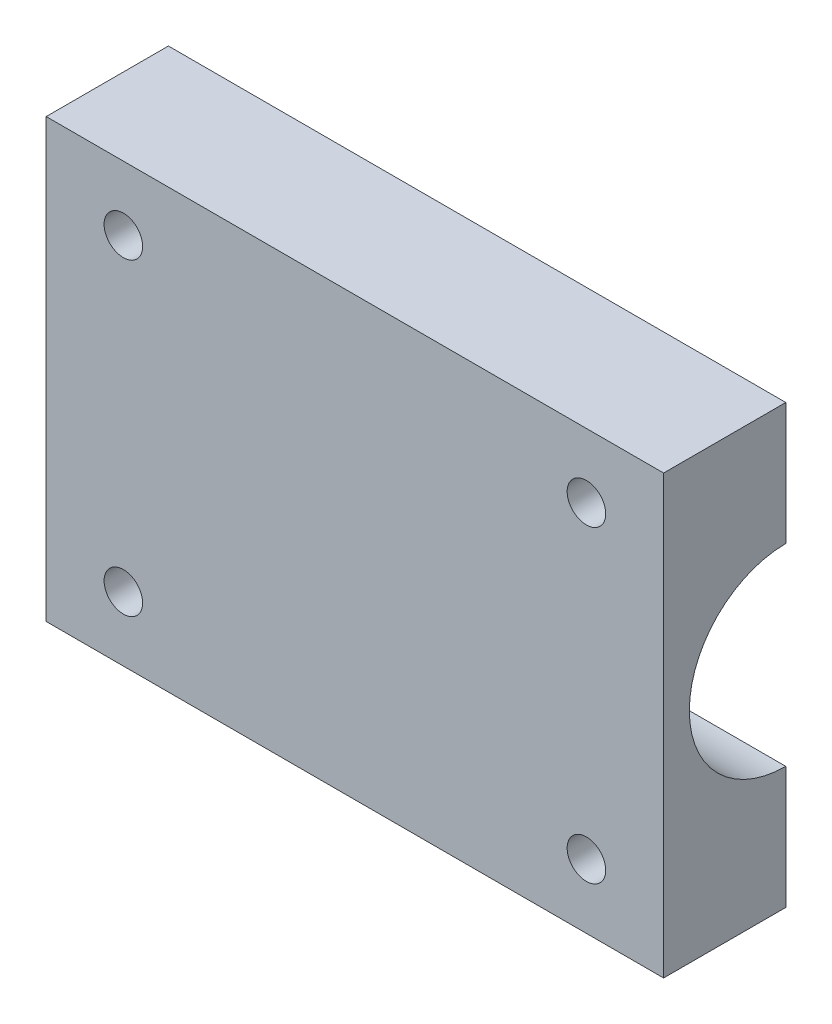
from build123d import *

# Parameters (mm, degrees)
SKETCH_1_W          = 48
SKETCH_1_H          = 34
SKETCH_1_R          = 1.5
EXTRUDE_1_DEPTH     = 9.5
SKETCH_2_R          = 7.5
CUT_EXTRUDE_1_DEPTH = 54.5


with BuildPart() as part:
    # 草图1 → 凸台-拉伸1 (new body)
    with BuildSketch(Plane.XY):
        with Locations((-0.042857143, -0.364285714)):
            Rectangle(SKETCH_1_W, SKETCH_1_H)
        with Locations((-18.042857143, 11.635714286)):
            Circle(SKETCH_1_R, mode=Mode.SUBTRACT)
        with Locations((17.957142857, 11.635714286)):
            Circle(SKETCH_1_R, mode=Mode.SUBTRACT)
        with Locations((-18.042857143, -12.364285714)):
            Circle(SKETCH_1_R, mode=Mode.SUBTRACT)
        with Locations((17.957142857, -12.364285714)):
            Circle(SKETCH_1_R, mode=Mode.SUBTRACT)
    extrude(amount=EXTRUDE_1_DEPTH)

    # 草图2 → 切除-拉伸1 (cut)
    with BuildSketch(Plane(origin=(23.957142857, 0, 0), x_dir=(0, 0, -1), z_dir=(1, 0, 0))):
        with Locations((0, -0.364285714)):
            Circle(SKETCH_2_R)
    extrude(amount=-CUT_EXTRUDE_1_DEPTH, mode=Mode.SUBTRACT)


solid = part.part
